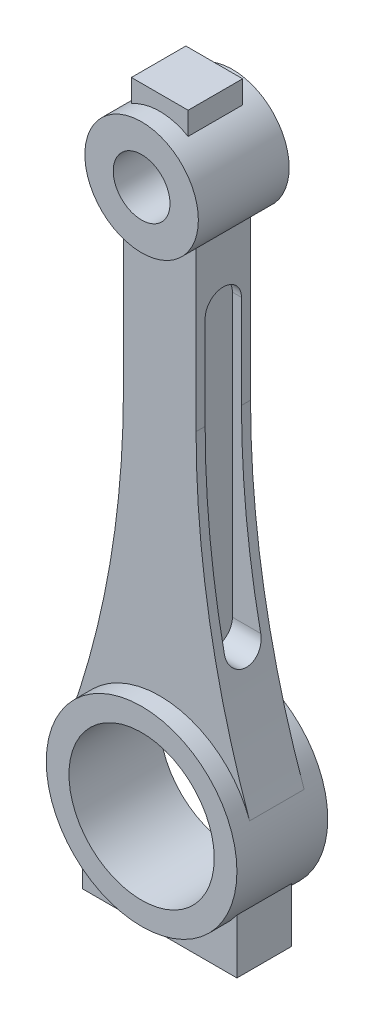
from build123d import *

# Parameters (mm, degrees)
SKETCH2_R             = 21
SKETCH2_R_2           = 16
BOSS_EXTRUDE1_DEPTH   = 10
SKETCH2_R_3           = 12.5
SKETCH2_R_4           = 6.25
BOSS_EXTRUDE1_2_DEPTH = 10
BOSS_EXTRUDE2_DEPTH   = 6
BOSS_EXTRUDE3_DEPTH   = 6
CUT_EXTRUDE1_DEPTH    = 62


with BuildPart() as part:
    # Sketch2 → Boss-Extrude1 (new, symmetric)
    with BuildSketch(Plane.XY):
        Circle(SKETCH2_R)
        Circle(SKETCH2_R_2, mode=Mode.SUBTRACT)
    extrude(amount=BOSS_EXTRUDE1_DEPTH, both=True)



with BuildPart() as body_2:
    # Sketch2 → Boss-Extrude1 2 (new, symmetric)
    with BuildSketch(Plane.XY):
        with Locations((0, 120)):
            Circle(SKETCH2_R_3)
        with Locations((0, 120)):
            Circle(SKETCH2_R_4, mode=Mode.SUBTRACT)
    extrude(amount=BOSS_EXTRUDE1_2_DEPTH, both=True)


with BuildPart() as part_1:
    add(part.part)

    add(body_2.part)  # Boss-Extrude2 merges body 2
    # Sketch3 → Boss-Extrude2 (add, symmetric)
    with BuildSketch(Plane.XY):
        with BuildLine():
            Line((-8, 110.395313644), (-8, 75.395313644))
            ThreePointArc((-8, 75.395313644), (-10.96842855, 40.709642053), (-19.787382488, 7.032744434))
            ThreePointArc((-19.787382488, 7.032744434), (0, 21), (19.787382488, 7.032744434))
            ThreePointArc((19.787382488, 7.032744434), (10.96842855, 40.709642053), (8, 75.395313644))
            Line((8, 75.395313644), (8, 110.395313644))
            ThreePointArc((8, 110.395313644), (0, 107.5), (-8, 110.395313644))
        make_face()
    extrude(amount=BOSS_EXTRUDE2_DEPTH, both=True)

    # Sketch4 → Boss-Extrude3 (add, symmetric)
    with BuildSketch(Plane.XY):
        with BuildLine():
            Line((0, 132.5), (0, 135.825317547))
            Line((0, 135.825317547), (-6.25, 135.825317547))
            Line((-6.25, 135.825317547), (-6.25, 130.825317547))
            ThreePointArc((-6.25, 130.825317547), (-3.235238064, 132.074072829), (0, 132.5))
        make_face()
        with BuildLine():
            Line((6.25, 135.825317547), (0, 135.825317547))
            Line((0, 135.825317547), (0, 132.5))
            ThreePointArc((0, 132.5), (3.235238064, 132.074072829), (6.25, 130.825317547))
            Line((6.25, 130.825317547), (6.25, 135.825317547))
        make_face()
        with BuildLine():
            ThreePointArc((-17, -12.328828006), (0, -21), (17, -12.328828006))
            Line((17, -12.328828006), (17, -24.328828006))
            Line((17, -24.328828006), (-17, -24.328828006))
            Line((-17, -24.328828006), (-17, -12.328828006))
        make_face()
    extrude(amount=BOSS_EXTRUDE3_DEPTH, both=True)

    # Sketch5 → Cut-Extrude1 (cut)
    with BuildSketch(Plane(origin=(6, 0, 0), x_dir=(0, 0, -1), z_dir=(1, 0, 0))):
        with BuildLine():
            Line((4, 96), (4, 34))
            ThreePointArc((4, 34), (0, 30), (-4, 34))
            Line((-4, 34), (-4, 96))
            ThreePointArc((-4, 96), (0, 100), (4, 96))
        make_face()
    cut_extrude1 = extrude(amount=CUT_EXTRUDE1_DEPTH, mode=Mode.SUBTRACT)

    # Mirror1: Cut-Extrude1 across plane
    add(cut_extrude1.mirror(Plane(origin=(0, 0, 0), x_dir=(0, 0, 1), z_dir=(1, 0, 0))), mode=Mode.SUBTRACT)


solid = part_1.part
